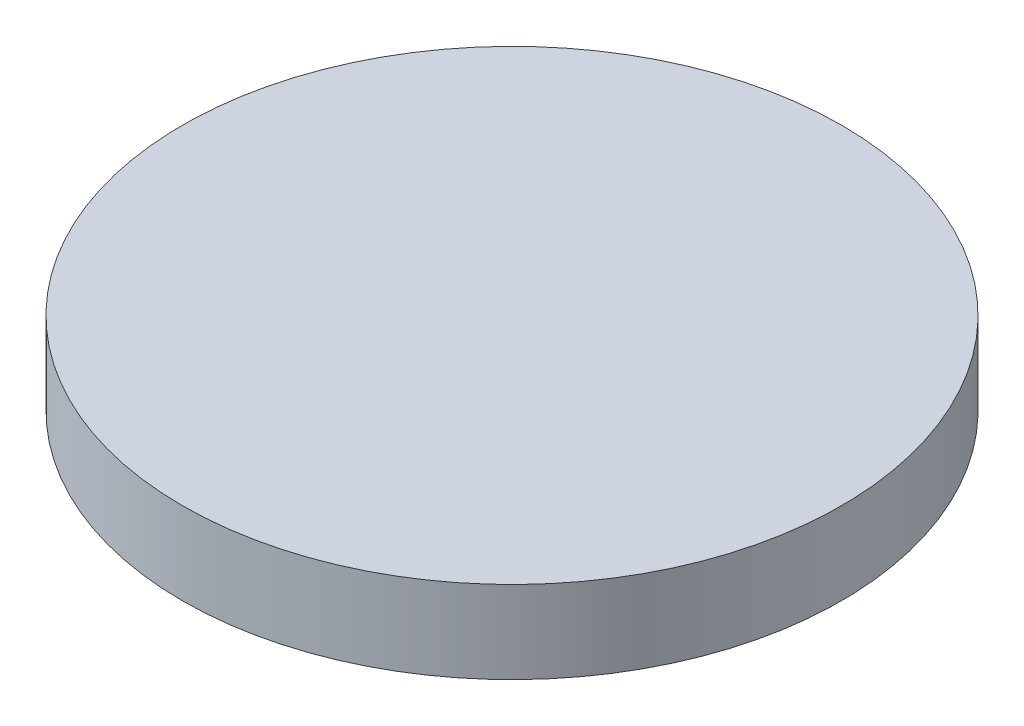
from build123d import *

# Parameters (mm, degrees)
SKETCH1_R           = 12
BOSS_EXTRUDE1_DEPTH = 3


with BuildPart() as part:
    # Sketch1 → Boss-Extrude1 (new body)
    with BuildSketch(Plane(origin=(0, 0, 0), x_dir=(1, 0, 0), z_dir=(0, 1, 0))):
        with Locations(Location((0, 0, 0), (0, 0, 270))):
            Circle(SKETCH1_R)
    extrude(amount=BOSS_EXTRUDE1_DEPTH)


solid = part.part
